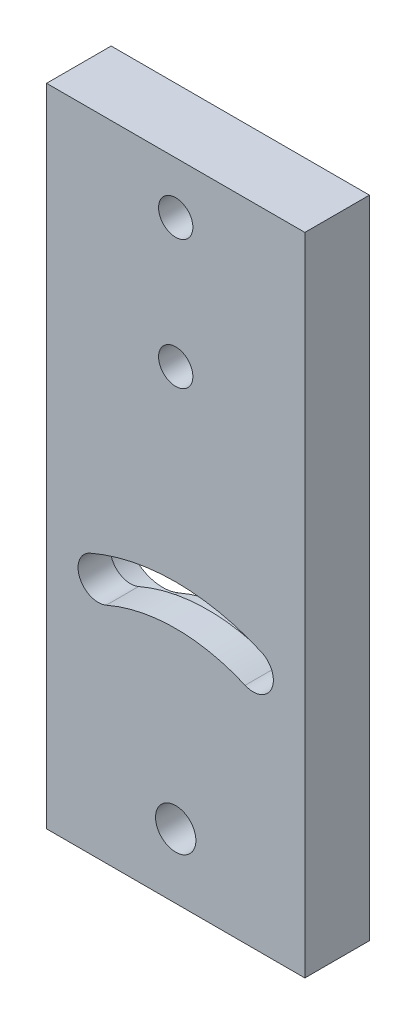
from build123d import *

# Parameters (mm, degrees)
SKETCH1_W           = 50.8
SKETCH1_H           = 127
SKETCH1_R           = 3.96875
SKETCH1_R_2         = 3.3734375
BOSS_EXTRUDE2_DEPTH = 12.7
CUT_EXTRUDE1_DEPTH  = 6.35
SKETCH3_R           = 5.55625
CUT_EXTRUDE2_DEPTH  = 6.35
CUT_EXTRUDE3_START  = -12.7
SKETCH4_R           = 7.62
CUT_EXTRUDE3_DEPTH  = 6.35


with BuildPart() as part:
    # Sketch1 → Boss-Extrude2 (new body)
    with BuildSketch(Plane.XY):
        with Locations((25.4, 63.5)):
            Rectangle(SKETCH1_W, SKETCH1_H)
        with Locations((25.4, 12.7)):
            Circle(SKETCH1_R, mode=Mode.SUBTRACT)
        with Locations((25.4, 116.84)):
            Circle(SKETCH1_R_2, mode=Mode.SUBTRACT)
        with Locations((25.4, 91.44)):
            Circle(SKETCH1_R_2, mode=Mode.SUBTRACT)
        with BuildLine():
            ThreePointArc((42.2275, 51.256646253), (25.4, 54.76875), (8.5725, 51.256646253))
            ThreePointArc((8.5725, 51.256646253), (6.522580542, 46.031726796), (11.7475, 43.981807338))
            ThreePointArc((11.7475, 43.981807338), (25.4, 46.83125), (39.0525, 43.981807338))
            ThreePointArc((39.0525, 43.981807338), (44.277419458, 46.031726796), (42.2275, 51.256646253))
        make_face(mode=Mode.SUBTRACT)
    extrude(amount=BOSS_EXTRUDE2_DEPTH)

    # Sketch1<3> → Cut-Extrude1 (cut)
    with BuildSketch(Plane.XY):
        with BuildLine():
            ThreePointArc((37.5285, 40.489884658), (25.4, 43.02125), (13.2715, 40.489884658))
            ThreePointArc((13.2715, 40.489884658), (3.030657863, 44.507726796), (7.0485, 54.748568933))
            ThreePointArc((7.0485, 54.748568933), (25.4, 58.57875), (43.7515, 54.748568933))
            ThreePointArc((43.7515, 54.748568933), (47.769342137, 44.507726796), (37.5285, 40.489884658))
        make_face()
        with BuildLine():
            ThreePointArc((39.0525, 43.981807338), (44.277419458, 46.031726796), (42.2275, 51.256646253))
            ThreePointArc((42.2275, 51.256646253), (25.4, 54.76875), (8.5725, 51.256646253))
            ThreePointArc((8.5725, 51.256646253), (6.522580542, 46.031726796), (11.7475, 43.981807338))
            ThreePointArc((11.7475, 43.981807338), (25.4, 46.83125), (39.0525, 43.981807338))
        make_face(mode=Mode.SUBTRACT)
    extrude(amount=CUT_EXTRUDE1_DEPTH, mode=Mode.SUBTRACT)

    # Sketch3 → Cut-Extrude2 (cut)
    with BuildSketch(Plane(origin=(0, 0, 0), x_dir=(-1, 0, 0), z_dir=(0, 0, -1))):
        with Locations(Location((-25.4, 116.84, 0), (0, 0, 180))):
            Circle(SKETCH3_R)
        with Locations(Location((-25.4, 91.44, 0), (0, 0, 180))):
            Circle(SKETCH3_R)
    extrude(amount=-CUT_EXTRUDE2_DEPTH, mode=Mode.SUBTRACT)

    # Sketch4 → Cut-Extrude3 (cut)
    with BuildSketch(Plane.XY.offset(12.7).offset(CUT_EXTRUDE3_START)):
        with Locations((25.4, 12.7)):
            Circle(SKETCH4_R)
    extrude(amount=CUT_EXTRUDE3_DEPTH, mode=Mode.SUBTRACT)


solid = part.part
